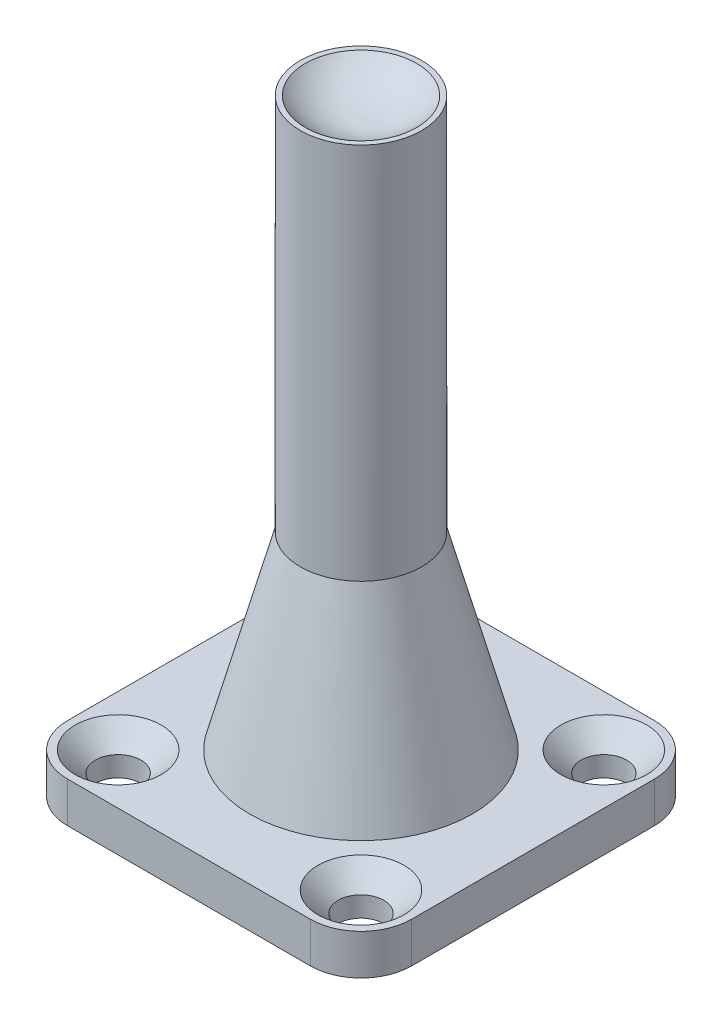
from build123d import *

# Parameters (mm, degrees)
SKETCH_1_W      = 34
SKETCH_1_H      = 34
SKETCH_1_R      = 2.25
EXTRUDE_1_DEPTH = 4
FILLET_1_R      = 5
SKETCH_2_R      = 6
EXTRUDE_2_DEPTH = 56
CHAMFER_1_SIZE  = 5
CHAMFER_1_SIZE2 = 18.660254038
CHAMFER_2_SIZE  = 2


with BuildPart() as part:
    # Эскиз1 → Бобышка-Вытянуть1 (new body)
    with BuildSketch(Plane(origin=(0, 0, 0), x_dir=(1, 0, 0), z_dir=(0, 1, 0))):
        Rectangle(SKETCH_1_W, SKETCH_1_H)
        with Locations(Location((-12, 12, 0), (0, 0, 270))):
            Circle(SKETCH_1_R, mode=Mode.SUBTRACT)
        with Locations(Location((12, 12, 0), (0, 0, 270))):
            Circle(SKETCH_1_R, mode=Mode.SUBTRACT)
        with Locations(Location((12, -12, 0), (0, 0, 270))):
            Circle(SKETCH_1_R, mode=Mode.SUBTRACT)
        with Locations(Location((-12, -12, 0), (0, 0, 270))):
            Circle(SKETCH_1_R, mode=Mode.SUBTRACT)
    extrude(amount=EXTRUDE_1_DEPTH)

    # Скругление1
    fillet_1_edges = [part.edges().sort_by_distance(p)[0] for p in [
        (17, 2, 17),
        (-17, 2, 17),
        (-17, 2, -17),
        (17, 2, -17),
    ]]
    fillet(fillet_1_edges, radius=FILLET_1_R)

    # Эскиз2 → Бобышка-Вытянуть2 (add)
    with BuildSketch(Plane(origin=(0, 4, 0), x_dir=(1, 0, 0), z_dir=(0, 1, 0))):
        with Locations(Location((0, 0, 0), (0, 0, 270))):
            Circle(SKETCH_2_R)
    extrude(amount=EXTRUDE_2_DEPTH)

    # Эскиз7 → Вырез-Повернуть3 (revolve, cut)
    with BuildSketch(Plane.XY):
        with BuildLine():
            Line((5.5, 60), (0, 60))
            Line((0, 60), (0, 58))
            ThreePointArc((0, 58), (2.979435889, 58.369051304), (5.5, 60))
        make_face()
    revolve(axis=Axis((0, 82.404747685, 0), (0, -1, 0)), mode=Mode.SUBTRACT)

    # Фаска1
    chamfer_1_edges = [part.edges().sort_by_distance(p)[0] for p in [
        (0, 4, -6),
    ]]
    chamfer_1_side = [part.faces().sort_by_distance(p)[0] for p in [
        (0, 4, 16.519167389),
    ]]
    chamfer(chamfer_1_edges, length=CHAMFER_1_SIZE, length2=CHAMFER_1_SIZE2, reference=chamfer_1_side[0])

    # Фаска2
    chamfer_2_edges = [part.edges().sort_by_distance(p)[0] for p in [
        (-12, 4, -14.25),
        (12, 4, -14.25),
        (12, 4, 9.75),
        (-12, 4, 9.75),
    ]]
    chamfer(chamfer_2_edges, length=CHAMFER_2_SIZE)


solid = part.part
